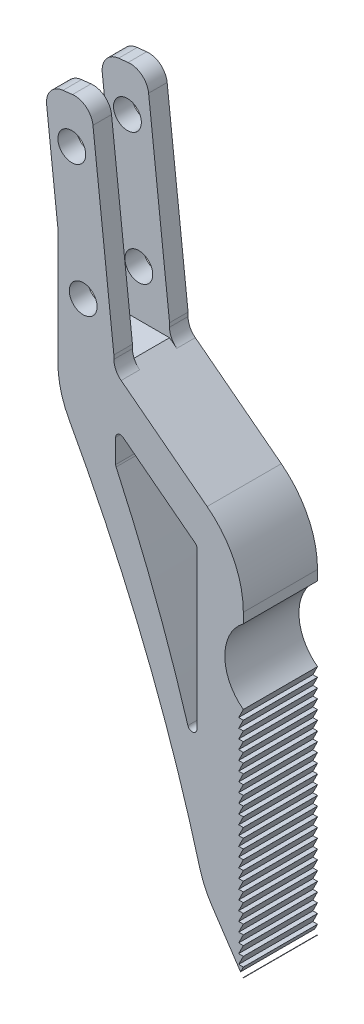
from build123d import *

# Parameters (mm, degrees)
BOSS_EXTRUDE1_DEPTH     = 4
SKETCH2_W               = 20
SKETCH2_H               = 25
CUT_EXTRUDE1_DEPTH      = 2
CUT_EXTRUDE2_DEPTH      = 78.016302468
CUT_EXTRUDE2_DEPTH_BACK = 78.016302468
CUT_EXTRUDE3_DEPTH      = 78.016302468
LPATTERN1_COUNT         = 26
LPATTERN1_PITCH         = 1.0025
CUT_EXTRUDE4_DEPTH      = 78.016302468
CUT_EXTRUDE5_DEPTH      = 78.016302468
FILLET1_R               = 10
FILLET2_R               = 2
FILLET3_R               = 0.5
SKETCH8_R               = 1.5
CUT_EXTRUDE6_DEPTH      = 77.75916694


with BuildPart() as part:
    # Sketch1 → Boss-Extrude1 (new, symmetric)
    with BuildSketch(Plane.XY):
        Polygon((0, 0), (-20, 29.933259094), (-20, 60.063259094), (-21.435566599, 72.983752449), (-16.435566599, 73.539291065), (-13.957864372, 51.239291065), (-13.957864372, 49.839291065), (0, 39.101256812), align=None)
    extrude(amount=BOSS_EXTRUDE1_DEPTH, both=True)

    # Sketch2 → Cut-Extrude1 (cut, symmetric)
    with BuildSketch(Plane.XY):
        with Locations((-23.957864372, 62.339291065)):
            Rectangle(SKETCH2_W, SKETCH2_H)
    extrude(amount=CUT_EXTRUDE1_DEPTH, both=True, mode=Mode.SUBTRACT)

    # Sketch3 → Cut-Extrude2 (cut, two sides: drawn at the far end of the back side and taken through both)
    with BuildSketch(Plane.XY.offset(4).offset(-CUT_EXTRUDE2_DEPTH_BACK)):
        with BuildLine():
            Line((92.75057696, 102.664189532), (0, 33.101256812))
            ThreePointArc((0, 33.101256812), (-2, 29.101256812), (0, 25.101256812))
            Line((0, 25.101256812), (92.75057696, -44.461675908))
            Line((92.75057696, -44.461675908), (324.62701936, -44.461675908))
            Line((324.62701936, -44.461675908), (324.62701936, 102.664189532))
            Line((324.62701936, 102.664189532), (92.75057696, 102.664189532))
        make_face()
    extrude(amount=CUT_EXTRUDE2_DEPTH + CUT_EXTRUDE2_DEPTH_BACK, mode=Mode.SUBTRACT)

    # Sketch5 → Cut-Extrude3 (cut, through all)
    with BuildSketch(Plane.XY.offset(4)):
        Polygon((0, 25.101256812), (-0.5, 24.101256812), (0, 24.101256812), align=None)
    cut_extrude3 = extrude(amount=-CUT_EXTRUDE3_DEPTH, mode=Mode.SUBTRACT)

    # LPattern1: Cut-Extrude3 ×26
    with Locations(*[(0, -i * LPATTERN1_PITCH, 0) for i in range(1, LPATTERN1_COUNT)]):
        add(cut_extrude3, mode=Mode.SUBTRACT)

    # Sketch6 → Cut-Extrude4 (cut, through all)
    with BuildSketch(Plane.XY.offset(4)):
        with BuildLine():
            Line((-20, 44.933259094), (-20, 29.933259094))
            Line((-20, 29.933259094), (-4.285038976, 6.413259094))
            ThreePointArc((-4.285038976, 6.413259094), (-10.885215286, 26.186200074), (-20, 44.933259094))
        make_face()
    extrude(amount=-CUT_EXTRUDE4_DEPTH, mode=Mode.SUBTRACT)

    # Sketch7 → Cut-Extrude5 (cut, through all)
    with BuildSketch(Plane.XY.offset(4)):
        with BuildLine():
            Line((-13.766052386, 44.644985221), (-5, 37.901104619))
            Line((-5, 37.901104619), (-5, 17.284985221))
            ThreePointArc((-5, 17.284985221), (-8.914419056, 29.30831158), (-13.766052386, 40.984985221))
            Line((-13.766052386, 40.984985221), (-13.766052386, 44.644985221))
        make_face()
    extrude(amount=-CUT_EXTRUDE5_DEPTH, mode=Mode.SUBTRACT)

    # Fillet1
    fillet1_edges = [part.edges().sort_by_distance(p)[0] for p in [
        (-20, 44.933259094, 0),
        (-4.285038976, 6.413259094, 0),
        (0, 39.101256812, 0),
    ]]
    fillet(fillet1_edges, radius=FILLET1_R)

    # Fillet2
    fillet2_edges = [part.edges().sort_by_distance(p)[0] for p in [
        (-13.957864372, 49.839291065, -3),
        (-16.435566599, 73.539291065, -3),
        (-21.435566599, 72.983752449, -3),
        (-13.957864372, 49.839291065, 3),
        (-16.435566599, 73.539291065, 3),
        (-21.435566599, 72.983752449, 3),
    ]]
    fillet(fillet2_edges, radius=FILLET2_R)

    # Fillet3
    fillet3_edges = [part.edges().sort_by_distance(p)[0] for p in [
        (-13.766052386, 40.984985221, 0),
        (-13.766052386, 44.644985221, 0),
        (-5, 37.901104619, 0),
        (-5, 17.284985221, 0),
    ]]
    fillet(fillet3_edges, radius=FILLET3_R)

    # Sketch8 → Cut-Extrude6 (cut, through all)
    with BuildSketch(Plane.XY.offset(4)):
        with Locations((-18.498023971, 68.421521757)):
            Circle(SKETCH8_R)
        with Locations((-17.26946936, 54.831521757)):
            Circle(SKETCH8_R)
    extrude(amount=-CUT_EXTRUDE6_DEPTH, mode=Mode.SUBTRACT)


solid = part.part
